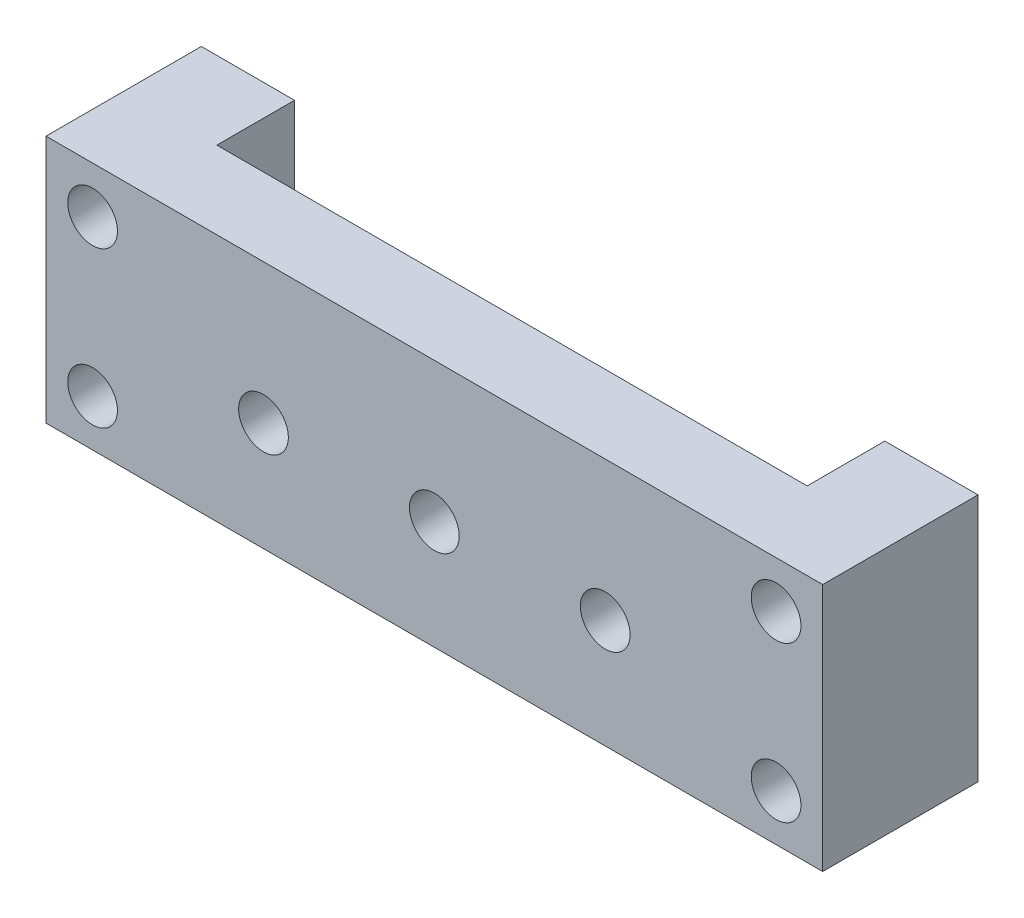
from build123d import *

# Parameters (mm, degrees)
SKETCH1_W               = 50
SKETCH1_H               = 16
BOSS_EXTRUDE1_DEPTH     = 5
SKETCH2_R               = 3
SKETCH2_W               = 6
SKETCH2_H               = 16
BOSS_EXTRUDE2_DEPTH     = 5
CUT_EXTRUDE1_DEPTH      = 28.037011669
CUT_EXTRUDE1_DEPTH_BACK = 28.037011669
SKETCH3_R               = 1.6


with BuildPart() as part:
    # Sketch1 → Boss-Extrude1 (new body)
    with BuildSketch(Plane.XY):
        with Locations((0, 1)):
            Rectangle(SKETCH1_W, SKETCH1_H)
    extrude(amount=BOSS_EXTRUDE1_DEPTH)

    # Sketch2 → Boss-Extrude2 (add)
    with BuildSketch(Plane(origin=(0, 0, 0), x_dir=(-1, 0, 0), z_dir=(0, 0, -1))):
        with Locations(Location((0, 0, 0), (0, 0, 180))):
            Circle(SKETCH2_R)
        with Locations((22, 1)):
            Rectangle(SKETCH2_W, SKETCH2_H)
        with Locations((-22, 1)):
            Rectangle(SKETCH2_W, SKETCH2_H)
    extrude(amount=BOSS_EXTRUDE2_DEPTH)

    # Sketch3 → Cut-Extrude1 (cut, two sides: drawn at the far end of the back side and taken through both)
    with BuildSketch(Plane(origin=(0, 0, 0), x_dir=(-1, 0, 0), z_dir=(0, 0, -1)).offset(-CUT_EXTRUDE1_DEPTH_BACK)):
        Circle(SKETCH3_R)
        with Locations((11, 0)):
            Circle(SKETCH3_R)
        with Locations((22, -4)):
            Circle(SKETCH3_R)
        with Locations((22, 6)):
            Circle(SKETCH3_R)
        with Locations(Location((-22, 6, 0), (0, 0, 180))):
            Circle(SKETCH3_R)
        with Locations(Location((-22, -4, 0), (0, 0, 180))):
            Circle(SKETCH3_R)
        with Locations(Location((-11, 0, 0), (0, 0, 180))):
            Circle(SKETCH3_R)
    extrude(amount=CUT_EXTRUDE1_DEPTH + CUT_EXTRUDE1_DEPTH_BACK, mode=Mode.SUBTRACT)


solid = part.part
